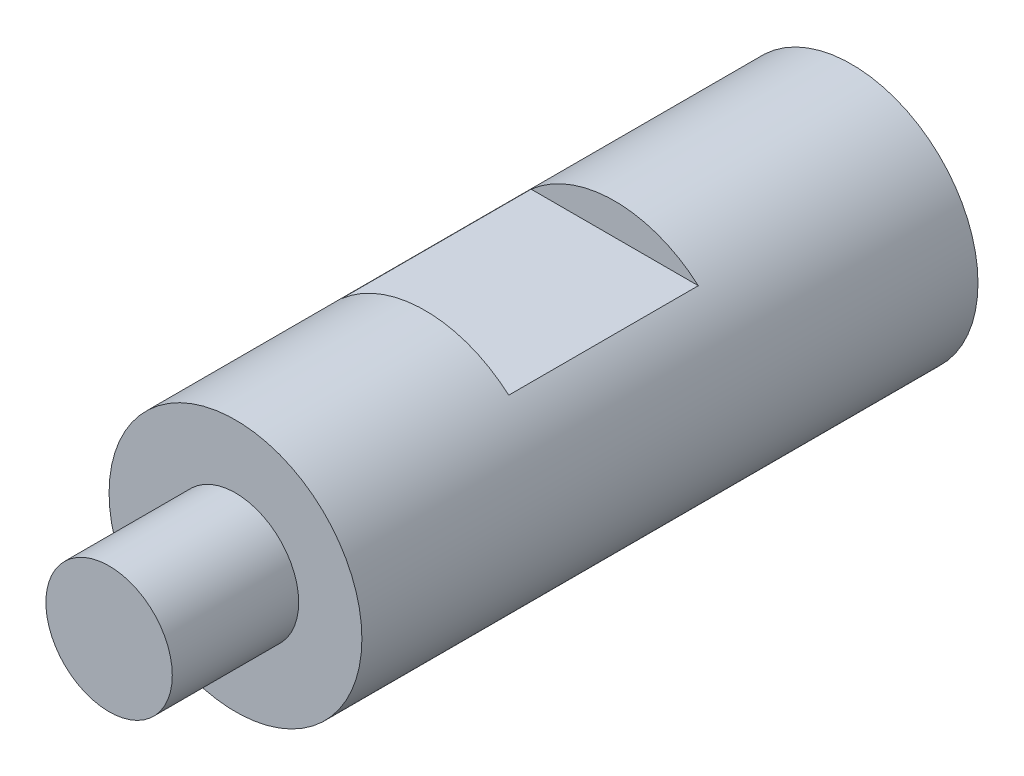
from build123d import *

# Parameters (mm, degrees)
SKETCH2_R                       = 6.35
BOSS_EXTRUDE1_DEPTH             = 30.9499
TAP_DRILL_FOR_1_4_20_TAP1_D     = 5.1054
TAP_DRILL_FOR_1_4_20_TAP1_DEPTH = 12.7
TAP_DRILL_FOR_1_4_20_TAP1_TIP   = 1.533816902
SKETCH6_R                       = 3.175
BOSS_EXTRUDE2_DEPTH             = 6.35
CUT_EXTRUDE1_DEPTH              = 39.365707865
CUT_EXTRUDE1_DEPTH_BACK         = 39.365707865
SKETCH7_W                       = 1.5875
SKETCH7_H                       = 9.525


with BuildPart() as part:
    # Sketch2 → Boss-Extrude1 (new body)
    with BuildSketch(Plane(origin=(0, 0, 0), x_dir=(0, 1, 0), z_dir=(0, 0, 1))):
        with Locations(Location((0, 0, 0), (0, 0, 270))):
            Circle(SKETCH2_R)
    extrude(amount=BOSS_EXTRUDE1_DEPTH)

    # Tap Drill for 1/4-20 Tap1
    with Locations(Plane(origin=(0, 0, 0), x_dir=(-1, 0, 0), z_dir=(0, 0, -1))):
        with Locations((0, 0)):
            Hole(TAP_DRILL_FOR_1_4_20_TAP1_D / 2, depth=TAP_DRILL_FOR_1_4_20_TAP1_DEPTH)
            with Locations((0, 0, -(TAP_DRILL_FOR_1_4_20_TAP1_DEPTH + TAP_DRILL_FOR_1_4_20_TAP1_TIP / 2))):  # 118° drill point
                Cone(0, TAP_DRILL_FOR_1_4_20_TAP1_D / 2, TAP_DRILL_FOR_1_4_20_TAP1_TIP, mode=Mode.SUBTRACT)

    # Sketch6 → Boss-Extrude2 (add)
    with BuildSketch(Plane.XY.offset(30.9499)):
        Circle(SKETCH6_R)
    extrude(amount=BOSS_EXTRUDE2_DEPTH)

    # Sketch7 → Cut-Extrude1 (cut, two sides: drawn at the far end of the back side and taken through both)
    with BuildSketch(Plane.YZ.offset(-CUT_EXTRUDE1_DEPTH_BACK)):
        with Locations((-5.55625, 16.6624)):
            Rectangle(SKETCH7_W, SKETCH7_H)
        with Locations((5.55625, 16.6624)):
            Rectangle(SKETCH7_W, SKETCH7_H)
    extrude(amount=CUT_EXTRUDE1_DEPTH + CUT_EXTRUDE1_DEPTH_BACK, mode=Mode.SUBTRACT)


solid = part.part
